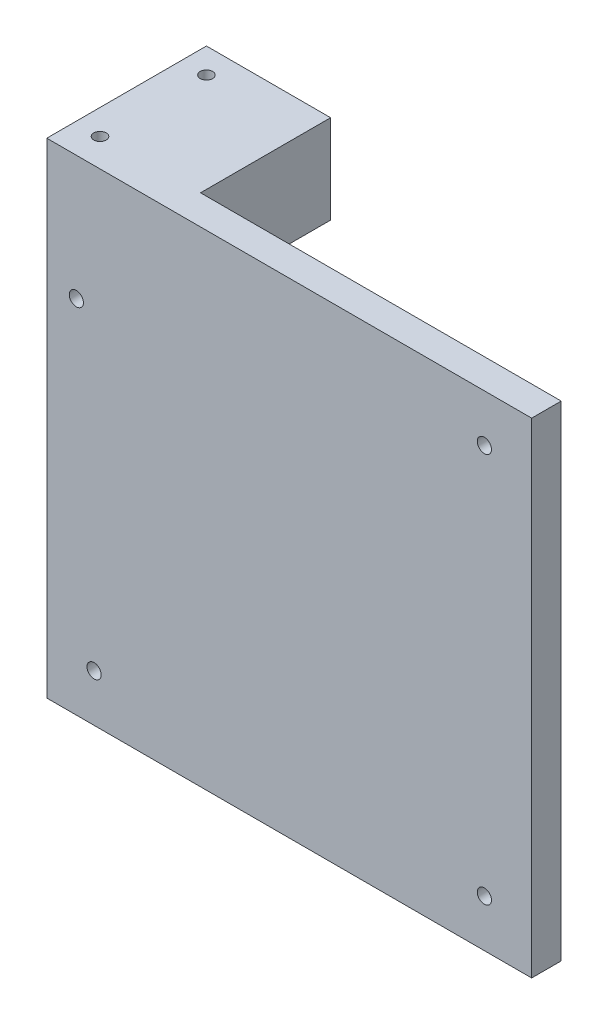
from build123d import *

# Parameters (mm, degrees)
SKETCH_1_W           = 82
SKETCH_1_H           = 82
SKETCH_1_R           = 35.5
EXTRUDE_1_DEPTH      = 245
SKETCH_2_W           = 82
SKETCH_2_H           = 82
EXTRUDE_2_DEPTH      = 27
SKETCH_3_W           = 8
SKETCH_3_H           = 20
CUT_EXTRUDE_1_DEPTH  = 245
SKETCH_4_R           = 4
CUT_EXTRUDE_2_DEPTH  = 20
FILLET_2_R           = 3
FILLET_3_R           = 3
FILLET_4_R           = 3
FILLET_5_R           = 3
SKETCH_5_R           = 1.05
CUT_EXTRUDE_3_DEPTH  = 10
EXTRUDE_START        = 0.2
SKETCH_6_R           = 1.05
EXTRUDE_3_DEPTH      = 0.2
CUT_EXTRUDE_5_REACH  = 263.591
SKETCH_7_W           = 20
SKETCH_7_H           = 65
CUT_EXTRUDE_6_REACH  = 263.591
SKETCH_8_W           = 41
SKETCH_8_H           = 20
SKETCH_9_R           = 1.2
CUT_EXTRUDE_7_DEPTH  = 10
CUT_EXTRUDE_8_REACH  = 263.591
SKETCH_10_W          = 245
SKETCH_10_H          = 82
SKETCH_11_W          = 20
SKETCH_11_H          = 17
CUT_EXTRUDE_9_DEPTH  = 20
CUT_EXTRUDE_10_DEPTH = 2
SKETCH_13_W          = 21
SKETCH_13_H          = 22
CUT_EXTRUDE_11_DEPTH = 2


with BuildPart() as part:
    # 草圖1 → 填料-伸長1 (new body)
    with BuildSketch(Plane.XY):
        Rectangle(SKETCH_1_W, SKETCH_1_H)
        Circle(SKETCH_1_R, mode=Mode.SUBTRACT)
    extrude(amount=EXTRUDE_1_DEPTH)

    # 草圖2 → 填料-伸長2 (add)
    with BuildSketch(Plane(origin=(0, 0, 0), x_dir=(-1, 0, 0), z_dir=(0, 0, -1))):
        Rectangle(SKETCH_2_W, SKETCH_2_H)
    extrude(amount=EXTRUDE_2_DEPTH)

    # 草圖3 → 除料-伸長1 (cut)
    with BuildSketch(Plane.XY.offset(245)):
        with Locations((-37, 0)):
            Rectangle(SKETCH_3_W, SKETCH_3_H)
    extrude(amount=-CUT_EXTRUDE_1_DEPTH, mode=Mode.SUBTRACT)

    # 草圖4 → 除料-伸長2 (cut)
    with BuildSketch(Plane.XY.offset(245)):
        with Locations((-32.9, 33)):
            Circle(SKETCH_4_R)
        with Locations((33.1, 32.9)):
            Circle(SKETCH_4_R)
        with Locations((33, -33.1)):
            Circle(SKETCH_4_R)
        with Locations((-33, -33)):
            Circle(SKETCH_4_R)
    extrude(amount=-CUT_EXTRUDE_2_DEPTH, mode=Mode.SUBTRACT)

    # 圓角2
    fillet_2_edges = [part.edges().sort_by_distance(p)[0] for p in [
        (-36.9, 33, 225),
    ]]
    fillet(fillet_2_edges, radius=FILLET_2_R)

    # 圓角3
    fillet_3_edges = [part.edges().sort_by_distance(p)[0] for p in [
        (29.1, 32.9, 225),
    ]]
    fillet(fillet_3_edges, radius=FILLET_3_R)

    # 圓角4
    fillet_4_edges = [part.edges().sort_by_distance(p)[0] for p in [
        (-37, -33, 225),
    ]]
    fillet(fillet_4_edges, radius=FILLET_4_R)

    # 圓角5
    fillet_5_edges = [part.edges().sort_by_distance(p)[0] for p in [
        (29, -33.1, 225),
    ]]
    fillet(fillet_5_edges, radius=FILLET_5_R)

    # 草圖5 → 除料-伸長3 (cut)
    with BuildSketch(Plane(origin=(0, 41, 0), x_dir=(1, 0, 0), z_dir=(0, 1, 0))):
        with Locations(Location((-36.75, 22.75, 0), (0, 0, 270))):
            Circle(SKETCH_5_R)
        with Locations(Location((-36.75, 4.75, 0), (0, 0, 270))):
            Circle(SKETCH_5_R)
    extrude(amount=-CUT_EXTRUDE_3_DEPTH, mode=Mode.SUBTRACT)

    # 草圖6 → 填料-伸長3 (add)
    with BuildSketch(Plane(origin=(0, 35, 0), x_dir=(1, 0, 0), z_dir=(0, 1, 0)).offset(EXTRUDE_START)):
        with Locations(Location((-36.75, 22.75, 0), (0, 0, 270))):
            Circle(SKETCH_6_R)
        with Locations(Location((-36.75, 4.75, 0), (0, 0, 270))):
            Circle(SKETCH_6_R)
    extrude(amount=-EXTRUDE_3_DEPTH)

    # 草圖7 → 除料-伸長5 (cut, up to next)
    with BuildSketch(Plane(origin=(-41, 0, 0), x_dir=(0, 0, -1), z_dir=(1, 0, 0)), mode=Mode.PRIVATE) as cut_extrude_5_sk1:
        with Locations((17, -8.5)):
            Rectangle(SKETCH_7_W, SKETCH_7_H)
    cut_extrude_5_tool1 = extrude(cut_extrude_5_sk1.sketch, amount=CUT_EXTRUDE_5_REACH, mode=Mode.PRIVATE) & part.part
    add(cut_extrude_5_tool1.solids().sort_by_distance((-41, -8.5, -17))[0], mode=Mode.SUBTRACT)

    # 草圖8 → 除料-伸長6 (cut, up to next)
    with BuildSketch(Plane(origin=(0, 41, 0), x_dir=(1, 0, 0), z_dir=(0, 1, 0)), mode=Mode.PRIVATE) as cut_extrude_6_sk1:
        with Locations((20.5, 17)):
            Rectangle(SKETCH_8_W, SKETCH_8_H)
    cut_extrude_6_tool1 = extrude(cut_extrude_6_sk1.sketch, amount=-CUT_EXTRUDE_6_REACH, mode=Mode.PRIVATE) & part.part
    add(cut_extrude_6_tool1.solids().sort_by_distance((20.5, 41, -17))[0], mode=Mode.SUBTRACT)

    # 草圖9 → 除料-伸長7 (cut)
    with BuildSketch(Plane(origin=(0, 0, -7), x_dir=(-1, 0, 0), z_dir=(0, 0, -1))):
        with Locations((-33, 33)):
            Circle(SKETCH_9_R)
        with Locations((-33, -33)):
            Circle(SKETCH_9_R)
        with Locations((33, -33)):
            Circle(SKETCH_9_R)
        with Locations((36, 20)):
            Circle(SKETCH_9_R)
    extrude(amount=-CUT_EXTRUDE_7_DEPTH, mode=Mode.SUBTRACT)

    # 草圖10 → 除料-伸長8 (cut, up to next)
    with BuildSketch(Plane.ZY.offset(41), mode=Mode.PRIVATE) as cut_extrude_8_sk1:
        with Locations((122.5, 0)):
            Rectangle(SKETCH_10_W, SKETCH_10_H)
    cut_extrude_8_tool1 = extrude(cut_extrude_8_sk1.sketch, amount=-CUT_EXTRUDE_8_REACH, mode=Mode.PRIVATE) & part.part
    add(cut_extrude_8_tool1.solids().sort_by_distance((-41, 0, 122.5))[0], mode=Mode.SUBTRACT)

    # 草圖11 → 除料-伸長9 (cut)
    with BuildSketch(Plane(origin=(0, 0, 0), x_dir=(0, 0, -1), z_dir=(1, 0, 0))):
        with Locations((17, 32.5)):
            Rectangle(SKETCH_11_W, SKETCH_11_H)
    extrude(amount=-CUT_EXTRUDE_9_DEPTH, mode=Mode.SUBTRACT)

    # 草圖12 → 除料-伸長10 (cut)
    with BuildSketch(Plane(origin=(0, 0, -7), x_dir=(-1, 0, 0), z_dir=(0, 0, -1))):
        Polygon((20, 41), (20, 24), (41, 24), (41, -41), (-41, -41), (-41, 41), align=None)
    extrude(amount=-CUT_EXTRUDE_10_DEPTH, mode=Mode.SUBTRACT)

    # 草圖13 → 除料-伸長11 (cut)
    with BuildSketch(Plane.XZ.offset(-24)):
        with Locations((-30.5, -16)):
            Rectangle(SKETCH_13_W, SKETCH_13_H)
    extrude(amount=-CUT_EXTRUDE_11_DEPTH, mode=Mode.SUBTRACT)


solid = part.part
